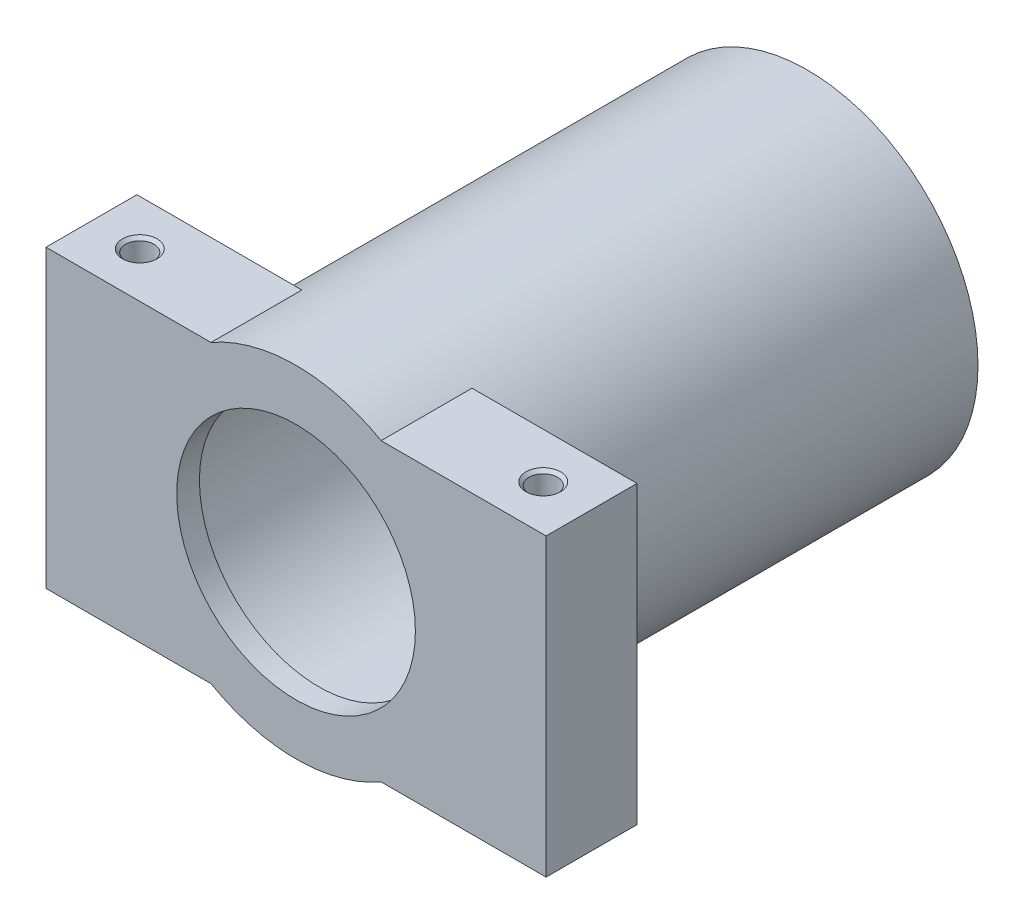
from build123d import *

# Parameters (mm, degrees)
SKETCH_1_R                  = 15
SKETCH_1_R_2                = 12.5
EXTRUDE_1_DEPTH             = 45
SKETCH_2_W                  = 44
SKETCH_2_H                  = 26
SKETCH_2_R                  = 10.5
EXTRUDE_2_DEPTH             = 8
HOLE_WIZARD_M3_1_AT_2_COUNT = 2
HOLE_WIZARD_M3_1_AT_2_PITCH = 35.5
HOLE_WIZARD_M3_1_AT_3_COUNT = 2
HOLE_WIZARD_M3_1_AT_3_PITCH = 25.27968552
SKETCH_6_R                  = 12.5
CUT_EXTRUDE_1_DEPTH         = 43


with BuildPart() as part:
    # 草图1 → 凸台-拉伸1 (new body)
    with BuildSketch(Plane.XY):
        with Locations(Location((0, 0, 0), (0, 0, 180))):
            Circle(SKETCH_1_R)
        with Locations(Location((0, 0, 0), (0, 0, 180))):
            Circle(SKETCH_1_R_2, mode=Mode.SUBTRACT)
    extrude(amount=EXTRUDE_1_DEPTH)

    # 草图2 → 凸台-拉伸2 (add)
    with BuildSketch(Plane.XY.offset(45)):
        Rectangle(SKETCH_2_W, SKETCH_2_H)
        Circle(SKETCH_2_R, mode=Mode.SUBTRACT)
    extrude(amount=-EXTRUDE_2_DEPTH)

    # 草图5 → M3 螺纹孔1 (revolve, cut)
    with BuildSketch(Plane(origin=(-17.75, 13, 41), x_dir=(0, 0, 1), z_dir=(1, 0, 0))):
        Polygon((0, 0), (0, 28), (1.25, 28), (1.25, 0.275), (1.525, 0), align=None)
    hole_wizard_m3_1 = revolve(axis=Axis((-17.75, 19.35, 41), (0, -1, 0)), mode=Mode.SUBTRACT)

    # M3 螺纹孔1 at 2: M3 螺纹孔1 ×2
    with Locations(*[(i * HOLE_WIZARD_M3_1_AT_2_PITCH, 0, 0) for i in range(1, HOLE_WIZARD_M3_1_AT_2_COUNT)]):
        add(hole_wizard_m3_1, mode=Mode.SUBTRACT)

    # M3 螺纹孔1 at 3: M3 螺纹孔1 ×2
    with Locations(*[Vector(0.7021448105364914, 0, -0.7120341740651741) * (i * HOLE_WIZARD_M3_1_AT_3_PITCH) for i in range(1, HOLE_WIZARD_M3_1_AT_3_COUNT)]):
        add(hole_wizard_m3_1, mode=Mode.SUBTRACT)

    # 草图6 → 切除-拉伸1 (cut)
    with BuildSketch(Plane(origin=(0, 0, 0), x_dir=(-1, 0, 0), z_dir=(0, 0, -1))):
        Circle(SKETCH_6_R)
    extrude(amount=-CUT_EXTRUDE_1_DEPTH, mode=Mode.SUBTRACT)


solid = part.part
